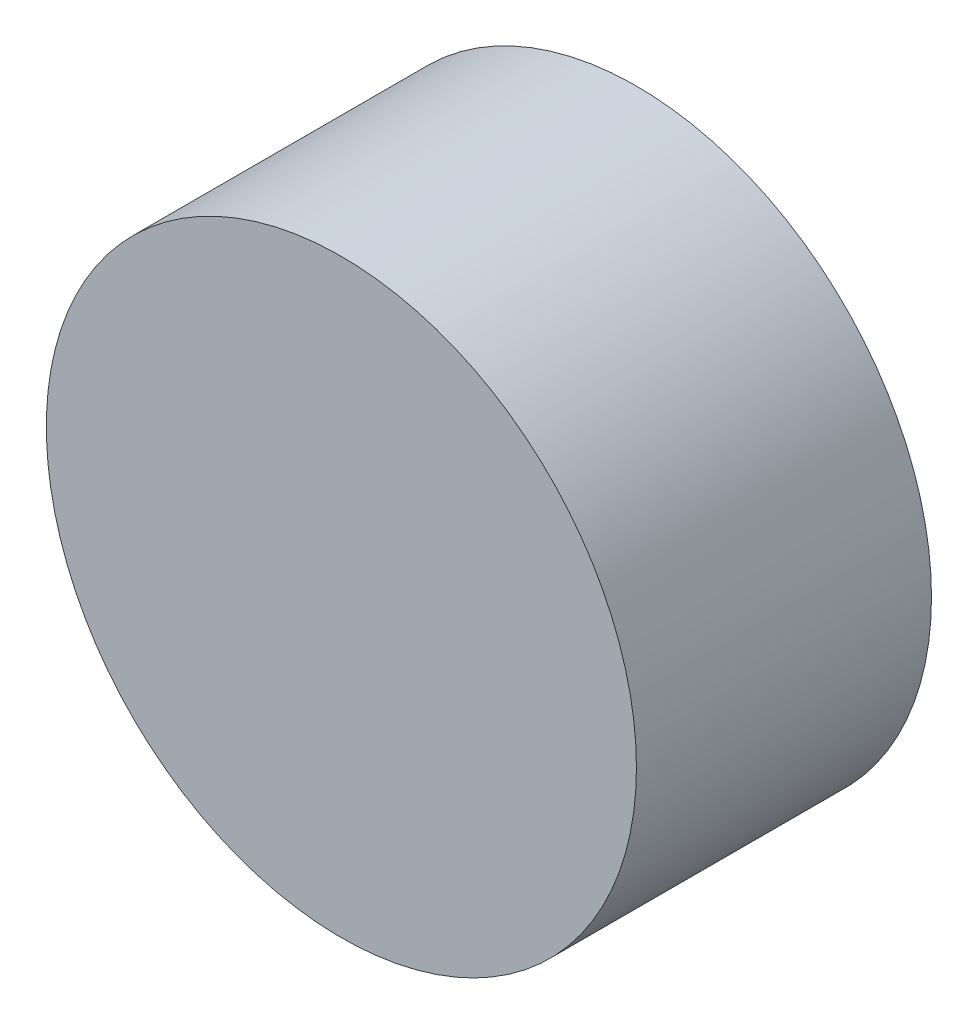
from build123d import *

# Parameters (mm, degrees)
SKETCH_1_R      = 3
EXTRUDE_1_DEPTH = 3


with BuildPart() as part:
    # ｽｹｯﾁ1 → ﾎﾞｽ - 押し出し1 (new body)
    with BuildSketch(Plane.XY):
        Circle(SKETCH_1_R)
    extrude(amount=EXTRUDE_1_DEPTH)


solid = part.part
